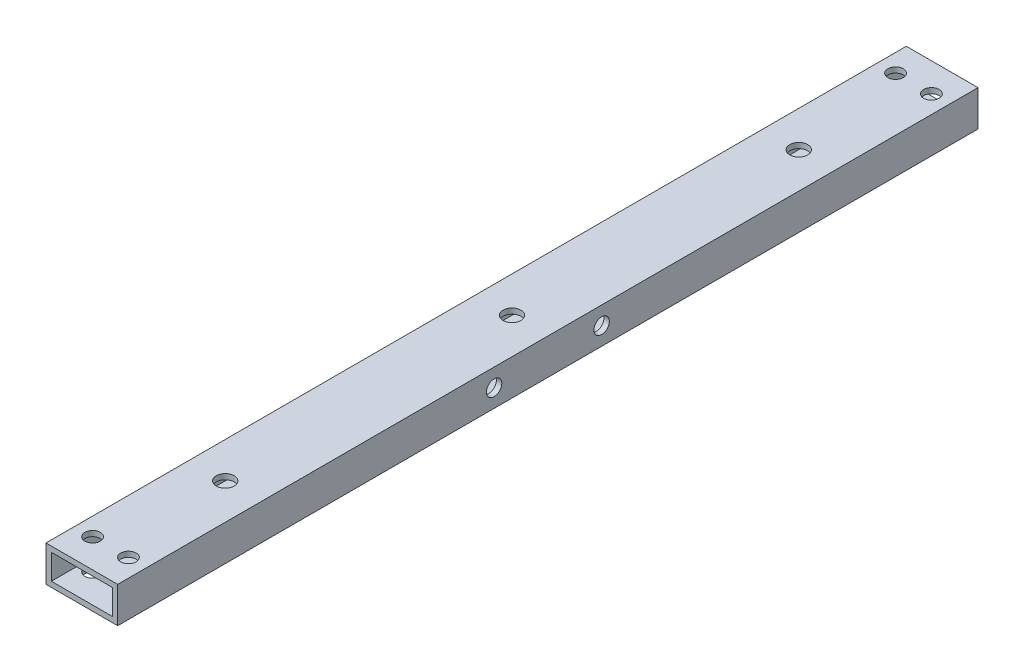
from build123d import *

# Parameters (mm, degrees)
SKETCH_1_W          = 20
SKETCH_1_H          = 10
SKETCH_1_W_2        = 17
SKETCH_1_H_2        = 7
EXTRUDE_1_DEPTH     = 240
SKETCH_2_R          = 2.15
SKETCH_2_R_2        = 2.5
CUT_EXTRUDE_1_DEPTH = 241.416305603
SKETCH_3_R          = 2.15
CUT_EXTRUDE_2_DEPTH = 241.883789409


with BuildPart() as part:
    # ｽｹｯﾁ1 → 押し出し-薄板1 (new body)
    with BuildSketch(Plane.XY):
        Rectangle(SKETCH_1_W, SKETCH_1_H)
        Rectangle(SKETCH_1_W_2, SKETCH_1_H_2, mode=Mode.SUBTRACT)
    extrude(amount=EXTRUDE_1_DEPTH)

    # ｽｹｯﾁ2 → ｶｯﾄ - 押し出し1 (cut, through all)
    with BuildSketch(Plane(origin=(0, 5, 0), x_dir=(1, 0, 0), z_dir=(0, 1, 0))):
        with Locations(Location((5, -232, 0), (0, 0, 270))):
            Circle(SKETCH_2_R)
        with Locations(Location((-5, -232, 0), (0, 0, 270))):
            Circle(SKETCH_2_R)
        with Locations(Location((5, -8, 0), (0, 0, 270))):
            Circle(SKETCH_2_R)
        with Locations(Location((-5, -8, 0), (0, 0, 270))):
            Circle(SKETCH_2_R)
        with Locations(Location((0, -40, 0), (0, 0, 270))):
            Circle(SKETCH_2_R_2)
        with Locations(Location((0, -200, 0), (0, 0, 270))):
            Circle(SKETCH_2_R_2)
        with Locations(Location((0, -120, 0), (0, 0, 270))):
            Circle(SKETCH_2_R_2)
    extrude(amount=-CUT_EXTRUDE_1_DEPTH, mode=Mode.SUBTRACT)

    # ｽｹｯﾁ3 → ｶｯﾄ - 押し出し2 (cut, through all)
    with BuildSketch(Plane(origin=(10, 0, 0), x_dir=(0, 0, -1), z_dir=(1, 0, 0))):
        with Locations((-105, 0)):
            Circle(SKETCH_3_R)
        with Locations(Location((-135, 0, 0), (0, 0, 90))):
            Circle(SKETCH_3_R)
    extrude(amount=-CUT_EXTRUDE_2_DEPTH, mode=Mode.SUBTRACT)


solid = part.part
